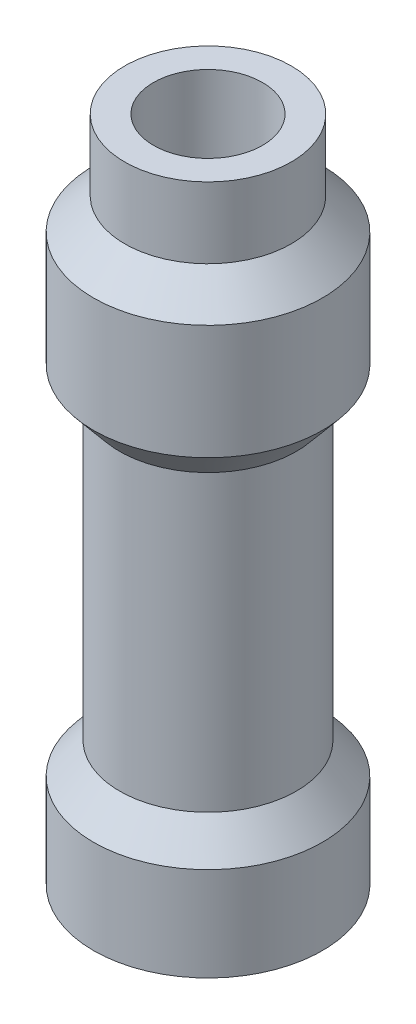
from build123d import *

# Parameters (mm, degrees)
FORO_FILETTATO_M3_5X0_6_1_D    = 2.9
FORO_FILETTATO_M3X0_5_2_REACH  = 36.283
FORO_FILETTATO_M3X0_5_2_BORE_R = 1.25


with BuildPart() as part:
    # Schizzo1 → Rivoluzione1 (revolve)
    with BuildSketch(Plane.XY, mode=Mode.PRIVATE) as rivoluzione1_sk:
        Polygon((0, 0), (5.49, 0), (5.49, 4.5), (4.24, 6), (4.24, 20.11), (5.49, 21.61), (5.49, 27.11), (3.995, 28.61), (3.995, 32.01), (2.615, 32.01), (2.615, 7.08), (0, 7.08), align=None)
    revolve(rivoluzione1_sk.sketch.rotate(Axis((0, 0, 0), (0, 1, 0)), 90), axis=Axis((0, 0, 0), (0, 1, 0)))

    # Foro filettato M3.5x0.6-1 (through all)
    with Locations(Plane(origin=(0, 0, 0), x_dir=(-1, 0, 0), z_dir=(0, -1, 0))):
        with Locations((0, 0)):
            Hole(FORO_FILETTATO_M3_5X0_6_1_D / 2)

    # Foro filettato M3x0.5-2 bore → Foro filettato M3x0.5-2 (cut, up to next)
    with BuildSketch(Plane(origin=(0, 0, -5.49), x_dir=(-1, 0, 0), z_dir=(0, 0, -1)), mode=Mode.PRIVATE) as foro_filettato_m3x0_5_2_sk1:
        with Locations((0, 24.36)):
            Circle(FORO_FILETTATO_M3X0_5_2_BORE_R)
    foro_filettato_m3x0_5_2_tool1 = extrude(foro_filettato_m3x0_5_2_sk1.sketch, amount=-FORO_FILETTATO_M3X0_5_2_REACH, mode=Mode.PRIVATE) & part.part
    add(foro_filettato_m3x0_5_2_tool1.solids().sort_by_distance((0, 24.36, -5.49))[0], mode=Mode.SUBTRACT)


solid = part.part
